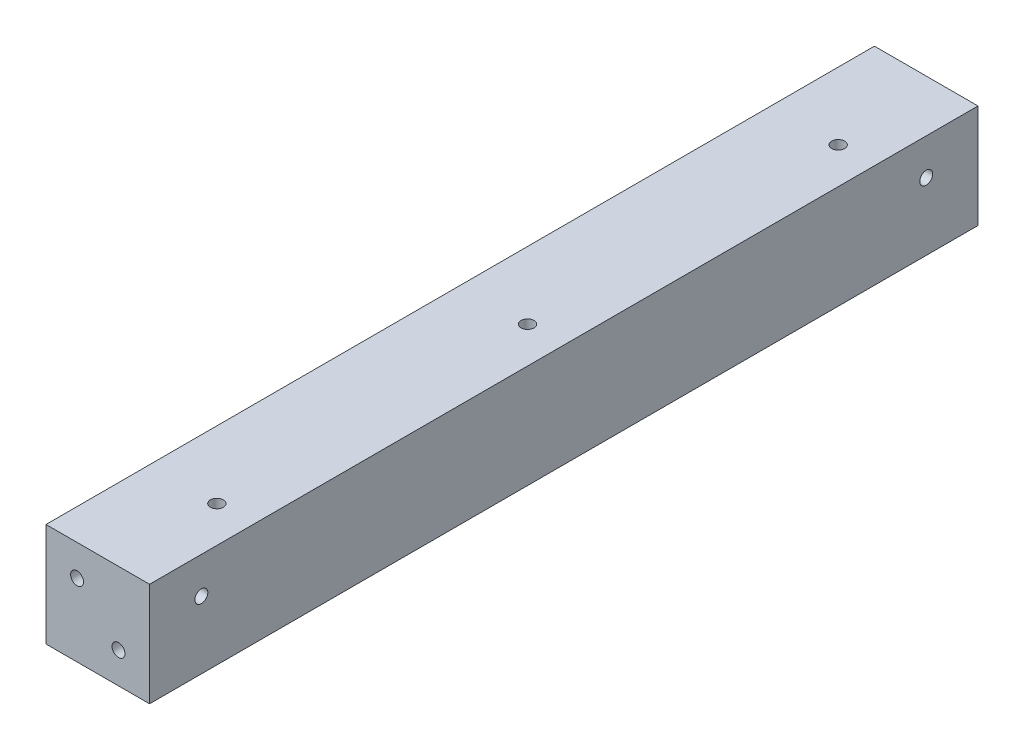
from build123d import *

# Parameters (mm, degrees)
IZIM1_W                     = 20
IZIM1_H                     = 20
Y_KSEKLIK_EKSTR_ZYON1_DEPTH = 160
IZIM13_R                    = 1.25
KES_EKSTR_ZYON1_DEPTH       = 10
KES_EKSTR_ZYON2_START       = -10
IZIM15_R                    = 1.25
KES_EKSTR_ZYON2_DEPTH       = 10
IZIM18_R                    = 1.25
KES_EKSTR_ZYON3_DEPTH       = 10
IZIM20_R                    = 1.25
KES_EKSTR_ZYON4_DEPTH       = 10
SKETCH1_R                   = 1.25
CUT_EXTRUDE1_DEPTH          = 10
SKETCH2_R                   = 1.25
CUT_EXTRUDE2_DEPTH          = 10


with BuildPart() as part:
    # Çizim1 → Yükseklik-Ekstrüzyon1 (new body)
    with BuildSketch(Plane.XY):
        with Locations((10, 10)):
            Rectangle(IZIM1_W, IZIM1_H)
    extrude(amount=Y_KSEKLIK_EKSTR_ZYON1_DEPTH)

    # Çizim13 → Kes-Ekstrüzyon1 (cut)
    with BuildSketch(Plane.XY.offset(160)):
        with Locations((14, 6)):
            Circle(IZIM13_R)
        with Locations((6, 14)):
            Circle(IZIM13_R)
    extrude(amount=-KES_EKSTR_ZYON1_DEPTH, mode=Mode.SUBTRACT)

    # Çizim15 → Kes-Ekstrüzyon2 (cut)
    with BuildSketch(Plane(origin=(0, 0, 0), x_dir=(-1, 0, 0), z_dir=(0, 0, -1)).offset(KES_EKSTR_ZYON2_START)):
        with Locations(Location((-14, 6, 0), (0, 0, 180))):
            Circle(IZIM15_R)
        with Locations(Location((-6, 14, 0), (0, 0, 180))):
            Circle(IZIM15_R)
    extrude(amount=KES_EKSTR_ZYON2_DEPTH, mode=Mode.SUBTRACT)

    # Çizim18 → Kes-Ekstrüzyon3 (cut)
    with BuildSketch(Plane(origin=(20, 0, 0), x_dir=(0, 0, -1), z_dir=(1, 0, 0))):
        with Locations((-10, 13)):
            Circle(IZIM18_R)
        with Locations((-150, 13)):
            Circle(IZIM18_R)
    extrude(amount=-KES_EKSTR_ZYON3_DEPTH, mode=Mode.SUBTRACT)

    # Çizim20 → Kes-Ekstrüzyon4 (cut)
    with BuildSketch(Plane.XZ):
        with Locations(Location((7, 10, 0), (0, 0, 270))):
            Circle(IZIM20_R)
        with Locations(Location((7, 150, 0), (0, 0, 270))):
            Circle(IZIM20_R)
    extrude(amount=-KES_EKSTR_ZYON4_DEPTH, mode=Mode.SUBTRACT)

    # Sketch1 → Cut-Extrude1 (cut)
    with BuildSketch(Plane(origin=(0, 20, 0), x_dir=(1, 0, 0), z_dir=(0, 1, 0))):
        with Locations(Location((13, -20, 0), (0, 0, 270))):
            Circle(SKETCH1_R)
        with Locations(Location((13, -80, 0), (0, 0, 270))):
            Circle(SKETCH1_R)
        with Locations(Location((13, -140, 0), (0, 0, 270))):
            Circle(SKETCH1_R)
    extrude(amount=-CUT_EXTRUDE1_DEPTH, mode=Mode.SUBTRACT)

    # Sketch2 → Cut-Extrude2 (cut)
    with BuildSketch(Plane.ZY):
        with Locations((20, 7)):
            Circle(SKETCH2_R)
        with Locations((80, 7)):
            Circle(SKETCH2_R)
        with Locations((140, 7)):
            Circle(SKETCH2_R)
    extrude(amount=-CUT_EXTRUDE2_DEPTH, mode=Mode.SUBTRACT)


solid = part.part
